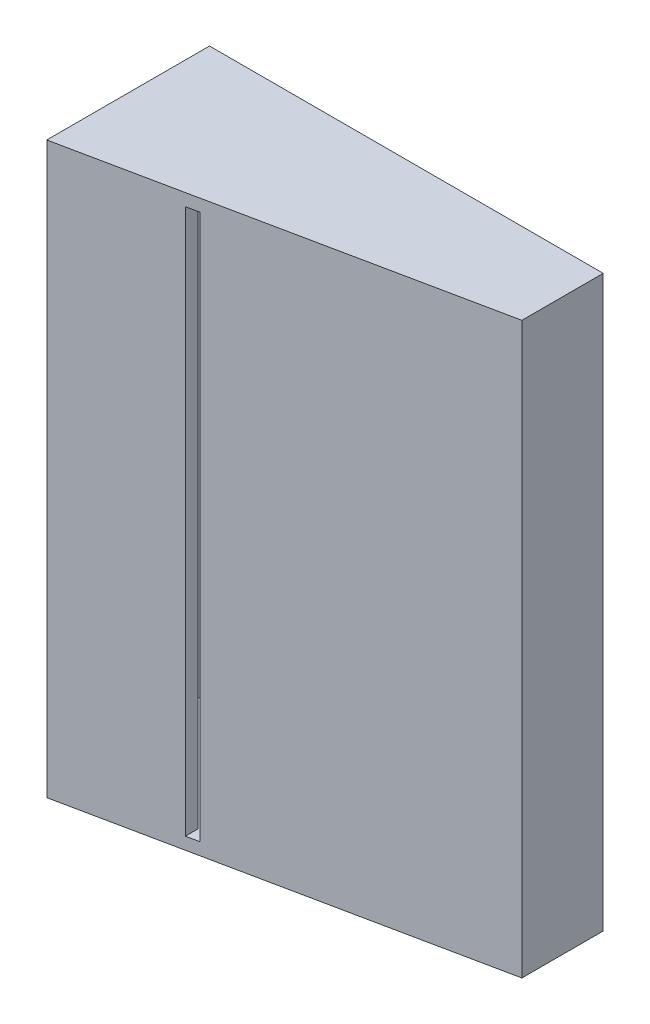
from build123d import *

# Parameters (mm, degrees)
SKETCH1_W           = 2.9
SKETCH1_H           = 19.8
BOSS_EXTRUDE1_DEPTH = 1.5
SKETCH2_W           = 22.5
SKETCH2_H           = 25.8
BOSS_EXTRUDE3_DEPTH = 1.5
BOSS_EXTRUDE4_DEPTH = 20
CUT_EXTRUDE1_DEPTH  = 70
CUT_EXTRUDE2_START  = -35
CUT_EXTRUDE2_DEPTH  = 33.5
CUT_EXTRUDE3_REACH  = 80.921
SKETCH6_W           = 1.5
SKETCH6_H           = 67


with BuildPart() as part:
    # Sketch1 → Boss-Extrude1 (new body)
    with BuildSketch(Plane.XY):
        with Locations((-45.437495374, 25.25)):
            Rectangle(SKETCH1_W, SKETCH1_H)
    extrude(amount=-BOSS_EXTRUDE1_DEPTH)

    # Sketch2 → Boss-Extrude3 (add)
    with BuildSketch(Plane(origin=(0, 0, -1.5), x_dir=(-1, 0, 0), z_dir=(0, 0, -1))):
        with Locations((35.637495374, 25.25)):
            Rectangle(SKETCH2_W, SKETCH2_H)
    extrude(amount=BOSS_EXTRUDE3_DEPTH)

    # Sketch3 → Boss-Extrude4 (add)
    with BuildSketch(Plane.XY):
        Polygon((-46.887495374, 15.25), (-46.887495374, 35.25), (-46.887495374, 60.25), (1.5, 60.25), (1.5, -9.75), (-46.887495374, -9.75), align=None)
    extrude(amount=BOSS_EXTRUDE4_DEPTH)

    # Sketch4 → Cut-Extrude1 (cut)
    with BuildSketch(Plane.XZ.offset(9.75)):
        Polygon((-46.887495374, 20), (1.5, 10), (1.5, 20), align=None)
    extrude(amount=-CUT_EXTRUDE1_DEPTH, mode=Mode.SUBTRACT)

    # Sketch5 → Cut-Extrude2 (cut)
    with BuildSketch(Plane.XZ.offset(9.75).offset(CUT_EXTRUDE2_START)):
        Polygon((0, 1.5), (0, 8.778299559), (-46.887495374, 18.468302113), (-46.887495374, 1.5), align=None)
    cut_extrude2 = extrude(amount=CUT_EXTRUDE2_DEPTH, mode=Mode.SUBTRACT)

    # Mirror1: Cut-Extrude2 across plane
    add(cut_extrude2.mirror(Plane.ZX.offset(25.25)), mode=Mode.SUBTRACT)

    # Cut-Extrude3: up to this plane
    cut_extrude3_end = Plane(origin=(-46.887495374, 109.660016278, 20), z_dir=(-0.2023881138557791, 0, -0.979305392290832))
    # Sketch6 → Cut-Extrude3 (cut, up to the surface)
    with BuildSketch(Plane(origin=(0, 0, 0), x_dir=(-1, 0, 0), z_dir=(0, 0, -1)), mode=Mode.PRIVATE) as cut_extrude3_sk1:
        with Locations((32.02, 25.25)):
            Rectangle(SKETCH6_W, SKETCH6_H)
    cut_extrude3_tool1 = split(extrude(cut_extrude3_sk1.sketch, amount=-CUT_EXTRUDE3_REACH, mode=Mode.PRIVATE), bisect_by=cut_extrude3_end, keep=Keep.BOTH, mode=Mode.PRIVATE)
    add(cut_extrude3_tool1.solids().sort_by_distance((-32.02, 25.25, 0))[0], mode=Mode.SUBTRACT)


solid = part.part
